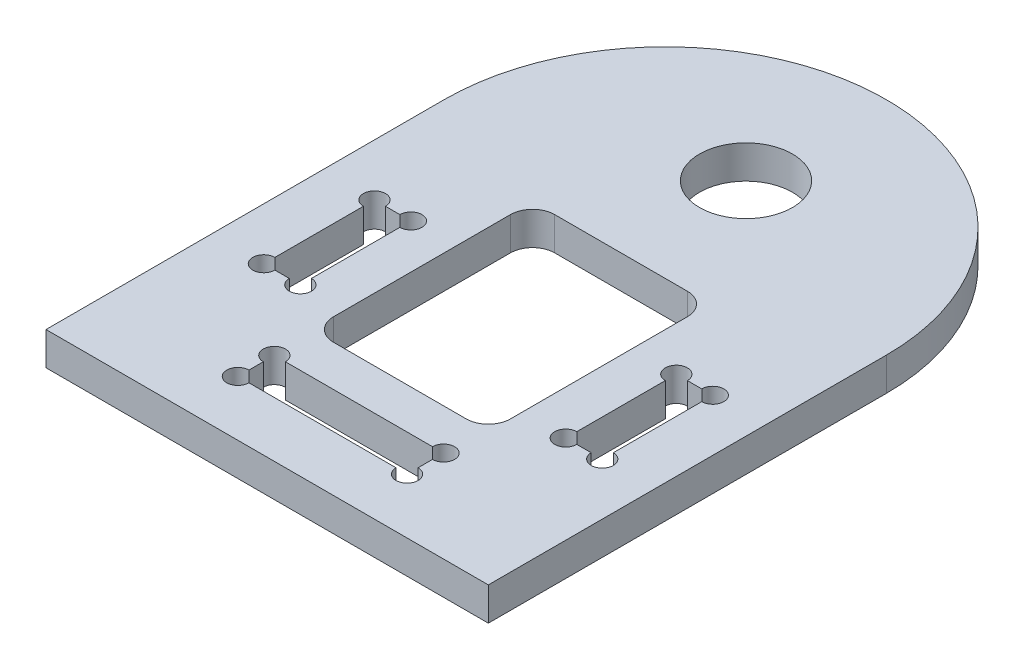
from build123d import *

# Parameters (mm, degrees)
SKETCH_1_R               = 4.2
EXTRUDE_1_DEPTH          = 3
CUT_EXTRUDE_1_DEPTH      = 44.0464865
CUT_EXTRUDE_1_DEPTH_BACK = 44.0464865
SKETCH_2_W               = 16
SKETCH_2_H               = 20
FILLET_1_R               = 2


with BuildPart() as part:
    # 草图1 → 凸台-拉伸1 (new body)
    with BuildSketch(Plane(origin=(0, 0, 0), x_dir=(1, 0, 0), z_dir=(0, 1, 0))):
        with BuildLine():
            ThreePointArc((20, 18), (0, 38), (-20, 18))
            Line((-20, 18), (-20, -18))
            Line((-20, -18), (20, -18))
            Line((20, -18), (20, 18))
        make_face()
        with Locations((0, 25.3)):
            Circle(SKETCH_1_R, mode=Mode.SUBTRACT)
        with BuildLine():
            Line((15.3, 6), (15.3, -2))
            ThreePointArc((15.3, -2), (16.007106781, -3.707106781), (14.3, -3))
            Line((14.3, -3), (13, -3))
            ThreePointArc((13, -3), (11.292893219, -3.707106781), (12, -2))
            Line((12, -2), (12, 6))
            ThreePointArc((12, 6), (11.292893219, 7.707106781), (13, 7))
            Line((13, 7), (14.3, 7))
            ThreePointArc((14.3, 7), (16.007106781, 7.707106781), (15.3, 6))
        make_face(mode=Mode.SUBTRACT)
        with BuildLine():
            Line((-12, 6), (-12, -2))
            ThreePointArc((-12, -2), (-11.292893219, -3.707106781), (-13, -3))
            Line((-13, -3), (-14.3, -3))
            ThreePointArc((-14.3, -3), (-16.007106781, -3.707106781), (-15.3, -2))
            Line((-15.3, -2), (-15.3, 6))
            ThreePointArc((-15.3, 6), (-16.007106781, 7.707106781), (-14.3, 7))
            Line((-14.3, 7), (-13, 7))
            ThreePointArc((-13, 7), (-11.292893219, 7.707106781), (-12, 6))
        make_face(mode=Mode.SUBTRACT)
        with BuildLine():
            Line((-6.65, -9.7), (6.65, -9.7))
            ThreePointArc((6.65, -9.7), (8.357106781, -8.992893219), (7.65, -10.7))
            Line((7.65, -10.7), (7.65, -12))
            ThreePointArc((7.65, -12), (8.357106781, -13.707106781), (6.65, -13))
            Line((6.65, -13), (-6.65, -13))
            ThreePointArc((-6.65, -13), (-8.357106781, -13.707106781), (-7.65, -12))
            Line((-7.65, -12), (-7.65, -10.7))
            ThreePointArc((-7.65, -10.7), (-8.357106781, -8.992893219), (-6.65, -9.7))
        make_face(mode=Mode.SUBTRACT)
    extrude(amount=EXTRUDE_1_DEPTH)

    # 草图2 → 切除-拉伸1 (cut, two sides: drawn at the far end of the back side and taken through both)
    with BuildSketch(Plane(origin=(0, 3, 0), x_dir=(1, 0, 0), z_dir=(0, 1, 0)).offset(-CUT_EXTRUDE_1_DEPTH_BACK)):
        with Locations((0, 4)):
            Rectangle(SKETCH_2_W, SKETCH_2_H)
    extrude(amount=CUT_EXTRUDE_1_DEPTH + CUT_EXTRUDE_1_DEPTH_BACK, mode=Mode.SUBTRACT)

    # 圆角1
    fillet_1_edges = [part.edges().sort_by_distance(p)[0] for p in [
        (-8, 1.5, 6),
        (8, 1.5, 6),
        (8, 1.5, -14),
        (-8, 1.5, -14),
    ]]
    fillet(fillet_1_edges, radius=FILLET_1_R)


solid = part.part
